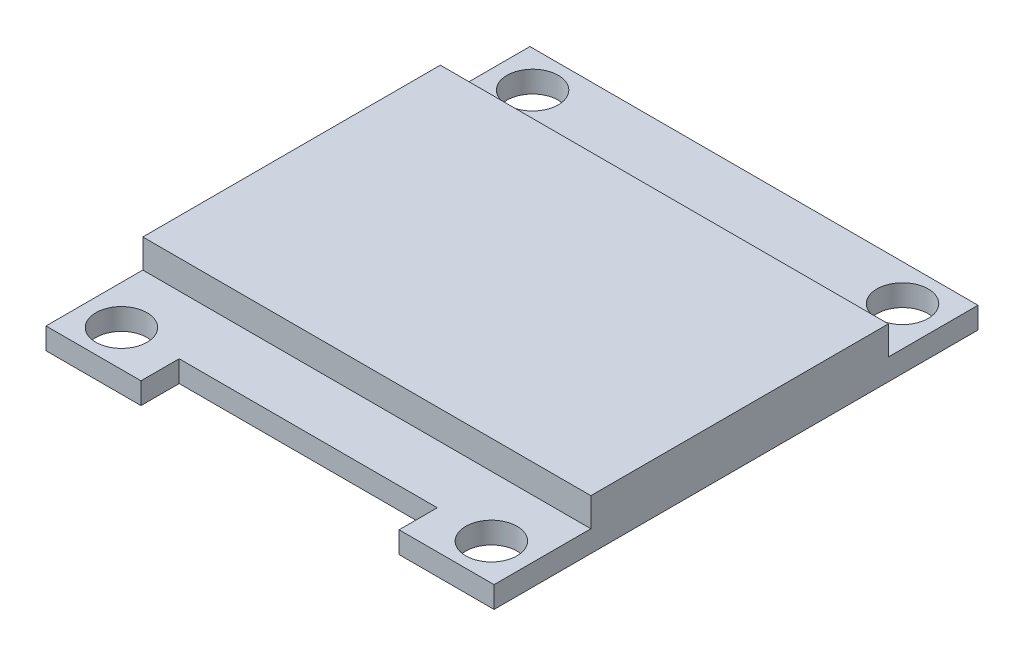
from build123d import *

# Parameters (mm, degrees)
SKETCH1_W           = 25
SKETCH1_H           = 27
BOSS_EXTRUDE1_DEPTH = 1.2
SKETCH2_W           = 25
SKETCH2_H           = 16.6
BOSS_EXTRUDE2_DEPTH = 1.6
SKETCH3_R           = 1.43
SKETCH3_W           = 14.4
SKETCH3_H           = 2.13
CUT_EXTRUDE1_DEPTH  = 1.2


with BuildPart() as part:
    # Sketch1 → Boss-Extrude1 (new body)
    with BuildSketch(Plane(origin=(0, 0, 0), x_dir=(1, 0, 0), z_dir=(0, 1, 0))):
        Rectangle(SKETCH1_W, SKETCH1_H)
    extrude(amount=BOSS_EXTRUDE1_DEPTH)

    # Sketch2 → Boss-Extrude2 (add)
    with BuildSketch(Plane(origin=(0, 1.2, 0), x_dir=(1, 0, 0), z_dir=(0, 1, 0))):
        with Locations((0, 0.2)):
            Rectangle(SKETCH2_W, SKETCH2_H)
    extrude(amount=BOSS_EXTRUDE2_DEPTH)

    # Sketch3 → Cut-Extrude1 (cut)
    with BuildSketch(Plane(origin=(0, 1.2, 0), x_dir=(1, 0, 0), z_dir=(0, 1, 0))):
        with Locations(Location((10.32, 11.47, 0), (0, 0, 270))):
            Circle(SKETCH3_R)
        with Locations(Location((-10.32, 11.47, 0), (0, 0, 270))):
            Circle(SKETCH3_R)
        with Locations(Location((-10.32, -11.47, 0), (0, 0, 270))):
            Circle(SKETCH3_R)
        with Locations(Location((10.32, -11.47, 0), (0, 0, 270))):
            Circle(SKETCH3_R)
        with Locations((0, -12.435)):
            Rectangle(SKETCH3_W, SKETCH3_H)
    extrude(amount=-CUT_EXTRUDE1_DEPTH, mode=Mode.SUBTRACT)


solid = part.part
